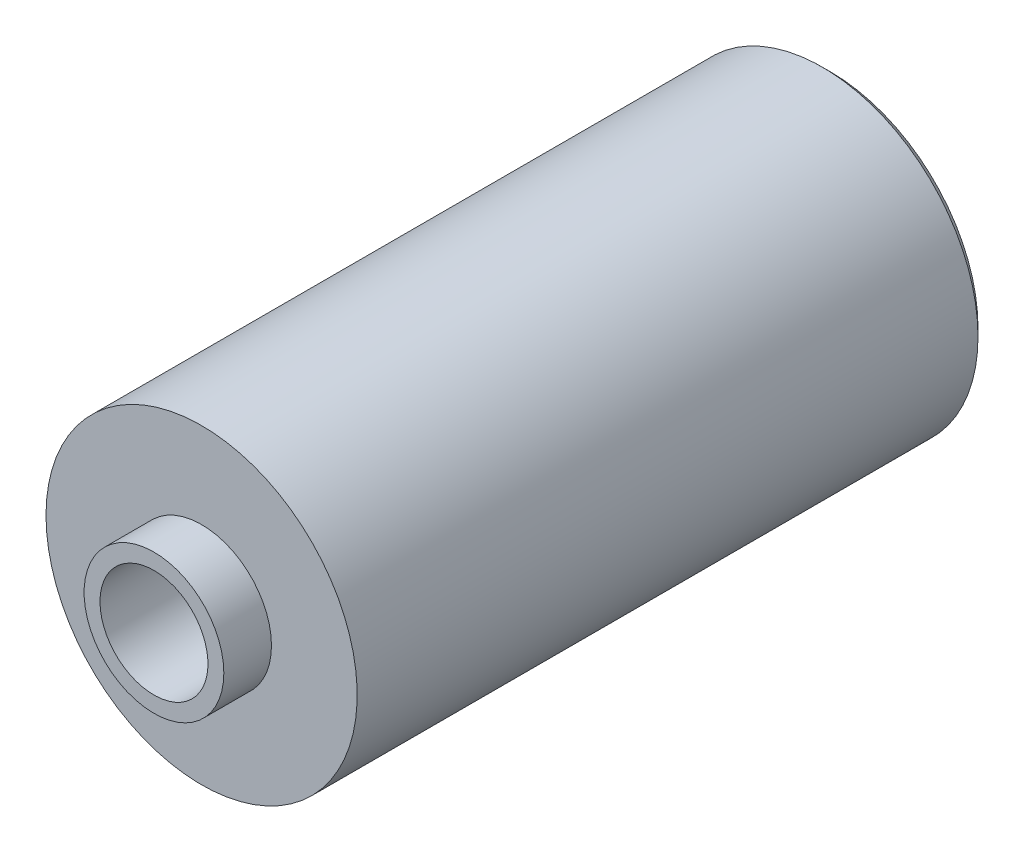
from build123d import *

# Parameters (mm, degrees)
SKETCH1_R           = 4.9
SKETCH1_R_2         = 1.7
BOSS_EXTRUDE1_DEPTH = 19.8
SKETCH2_R           = 2.2
SKETCH2_R_2         = 1.7
BOSS_EXTRUDE2_DEPTH = 1.5
CHAMFER1_SIZE       = 0.25


with BuildPart() as part:
    # Sketch1 → Boss-Extrude1 (new body)
    with BuildSketch(Plane.XY):
        with Locations(Location((0, 0, 0), (0, 0, 180))):
            Circle(SKETCH1_R)
        with Locations(Location((0, 0, 0), (0, 0, 180))):
            Circle(SKETCH1_R_2, mode=Mode.SUBTRACT)
    extrude(amount=BOSS_EXTRUDE1_DEPTH)

    # Sketch2 → Boss-Extrude2 (add)
    with BuildSketch(Plane.XY.offset(19.8)):
        Circle(SKETCH2_R)
        with Locations(Location((0, 0, 0), (0, 0, 180))):
            Circle(SKETCH2_R_2, mode=Mode.SUBTRACT)
    extrude(amount=BOSS_EXTRUDE2_DEPTH)

    # Chamfer1
    chamfer1_edges = [part.edges().sort_by_distance(p)[0] for p in [
        (4.9, 0, 0),
        (1.7, 0, 0),
    ]]
    chamfer(chamfer1_edges, length=CHAMFER1_SIZE)


solid = part.part
